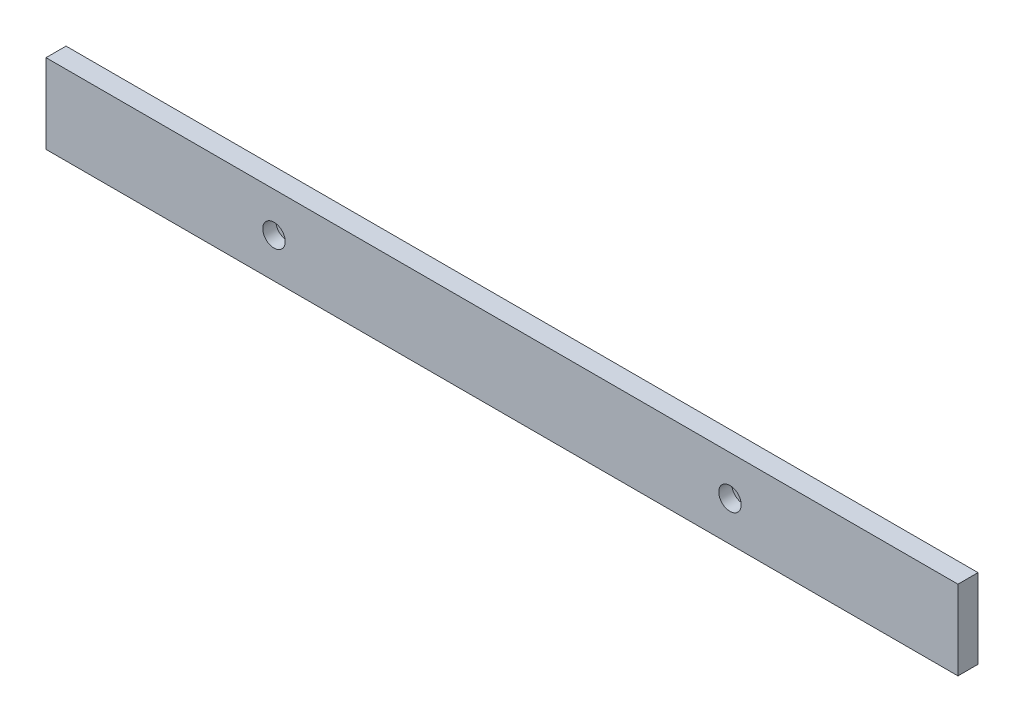
from build123d import *

# Parameters (mm, degrees)
SKETCH1_W           = 264
SKETCH1_H           = 23
SKETCH1_R           = 1.5
BOSS_EXTRUDE1_DEPTH = 5.8
SKETCH2_R           = 3.25
CUT_EXTRUDE1_DEPTH  = 3.8


with BuildPart() as part:
    # Sketch1 → Boss-Extrude1 (new body)
    with BuildSketch(Plane.XY):
        Rectangle(SKETCH1_W, SKETCH1_H)
        with Locations((-66, 0)):
            Circle(SKETCH1_R, mode=Mode.SUBTRACT)
        with Locations((66, 0)):
            Circle(SKETCH1_R, mode=Mode.SUBTRACT)
    extrude(amount=BOSS_EXTRUDE1_DEPTH)

    # Sketch2 → Cut-Extrude1 (cut)
    with BuildSketch(Plane.XY.offset(5.8)):
        with Locations((-66, 0)):
            Circle(SKETCH2_R)
        with Locations((66, 0)):
            Circle(SKETCH2_R)
    extrude(amount=-CUT_EXTRUDE1_DEPTH, mode=Mode.SUBTRACT)


solid = part.part
